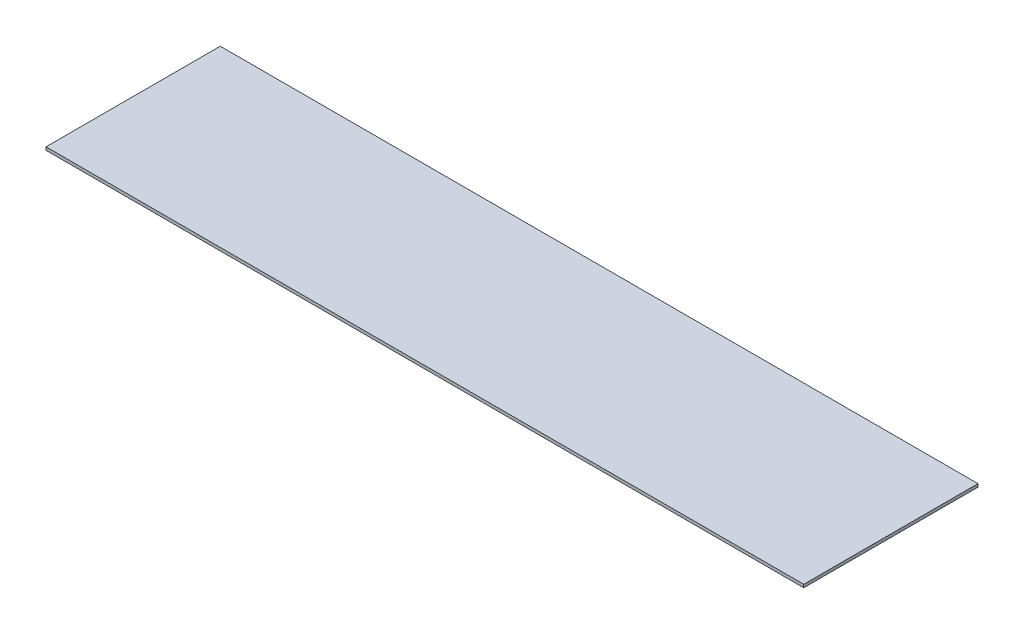
from build123d import *

# Parameters (mm, degrees)
SKETCH1_W           = 500
SKETCH1_H           = 115
BOSS_EXTRUDE1_DEPTH = 2


with BuildPart() as part:
    # Sketch1 → Boss-Extrude1 (new body)
    with BuildSketch(Plane(origin=(0, 0, 0), x_dir=(1, 0, 0), z_dir=(0, 1, 0))):
        with Locations((73.487712665, 61.592627599)):
            Rectangle(SKETCH1_W, SKETCH1_H)
    extrude(amount=BOSS_EXTRUDE1_DEPTH)


solid = part.part
